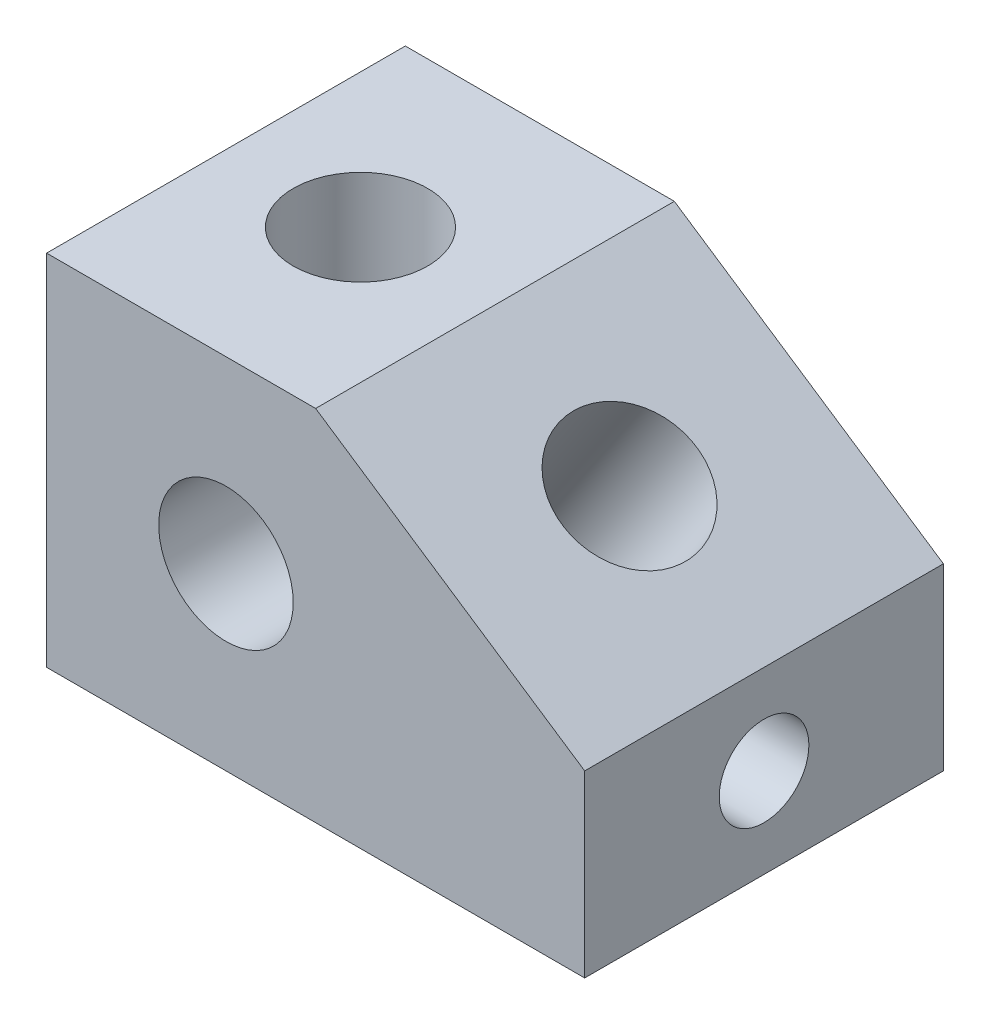
from build123d import *

# Parameters (mm, degrees)
EXTRUDE_1_DEPTH     = 40
SKETCH_2_R          = 7.5
CUT_EXTRUDE_1_DEPTH = 40
SKETCH_4_R          = 7.5
CUT_EXTRUDE_2_DEPTH = 67.159493241
SKETCH_5_R          = 5
CUT_EXTRUDE_3_DEPTH = 83.462112609
SKETCH_6_R          = 7.5
CUT_EXTRUDE_4_DEPTH = 71.051468561


with BuildPart() as part:
    # 스케치1 → 보스-돌출1 (new body)
    with BuildSketch(Plane.XY):
        Polygon((-34.308578315, 0), (25.691421685, 0), (25.691421685, 20), (-4.308578315, 40), (-34.308578315, 40), align=None)
    extrude(amount=EXTRUDE_1_DEPTH)

    # 스케치2 → 컷-돌출1 (cut)
    with BuildSketch(Plane.XY.offset(40)):
        with Locations((-14.308578315, 20)):
            Circle(SKETCH_2_R)
    extrude(amount=-CUT_EXTRUDE_1_DEPTH, mode=Mode.SUBTRACT)

    # 스케치4 → 컷-돌출2 (cut, through all)
    with BuildSketch(Plane(origin=(0, 40, 0), x_dir=(1, 0, 0), z_dir=(0, 1, 0))):
        with Locations(Location((-19.308578315, -20, 0), (0, 0, 270))):
            Circle(SKETCH_4_R)
    extrude(amount=-CUT_EXTRUDE_2_DEPTH, mode=Mode.SUBTRACT)

    # 스케치5 → 컷-돌출3 (cut, through all)
    with BuildSketch(Plane(origin=(25.691421685, 0, 0), x_dir=(0, 0, -1), z_dir=(1, 0, 0))):
        with Locations((-20, 10)):
            Circle(SKETCH_5_R)
    extrude(amount=-CUT_EXTRUDE_3_DEPTH, mode=Mode.SUBTRACT)

    # 스케치6 → 컷-돌출4 (cut, through all)
    with BuildSketch(Plane(origin=(17.135822057, 25.703733086, 0), x_dir=(0.8320502943378437, -0.5547001962252293, 0), z_dir=(0.5547001962252293, 0.8320502943378437, 0))):
        with Locations(Location((-7.745205326, -20, 0), (0, 0, 180))):
            Circle(SKETCH_6_R)
    extrude(amount=-CUT_EXTRUDE_4_DEPTH, mode=Mode.SUBTRACT)


solid = part.part
